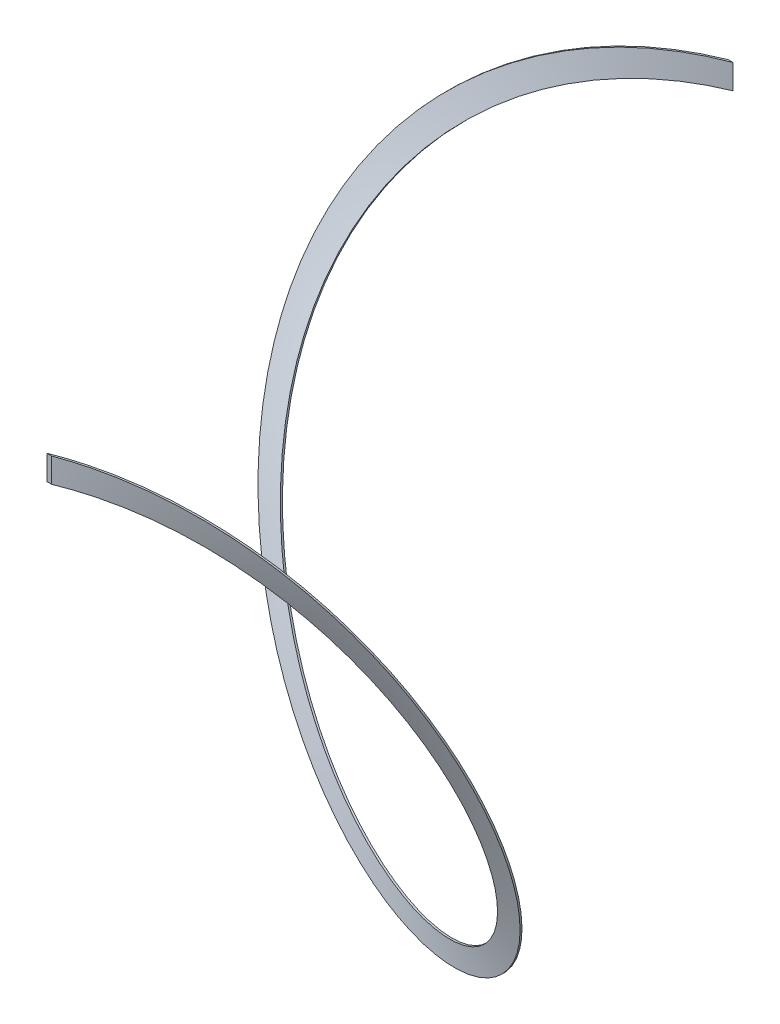
from build123d import *

# Parameters (mm, degrees)
SWEEP1_PITCH       = 833
SWEEP1_HEIGHT      = 833
SWEEP1_RADIUS      = 342.4
SWEEP1_START_ANGLE = -180
SKETCH2_W          = 6
SKETCH2_H          = 30


with BuildPart() as part:
    # Sweep1: sweep along a helix
    with BuildLine() as sweep1_path:
        add(Helix(SWEEP1_PITCH, SWEEP1_HEIGHT, SWEEP1_RADIUS, center=(0, 0, 0), direction=(0, 0, 1), mode=Mode.PRIVATE).rotate(Axis((0, 0, 0), (0, 0, 1)), SWEEP1_START_ANGLE))
    # Sketch2 → Sweep1 (sweep)
    with BuildSketch(Plane.XY):
        with Locations((0, 327.4)):
            Rectangle(SKETCH2_W, SKETCH2_H)
    sweep(path=sweep1_path.line, is_frenet=True)


solid = part.part
